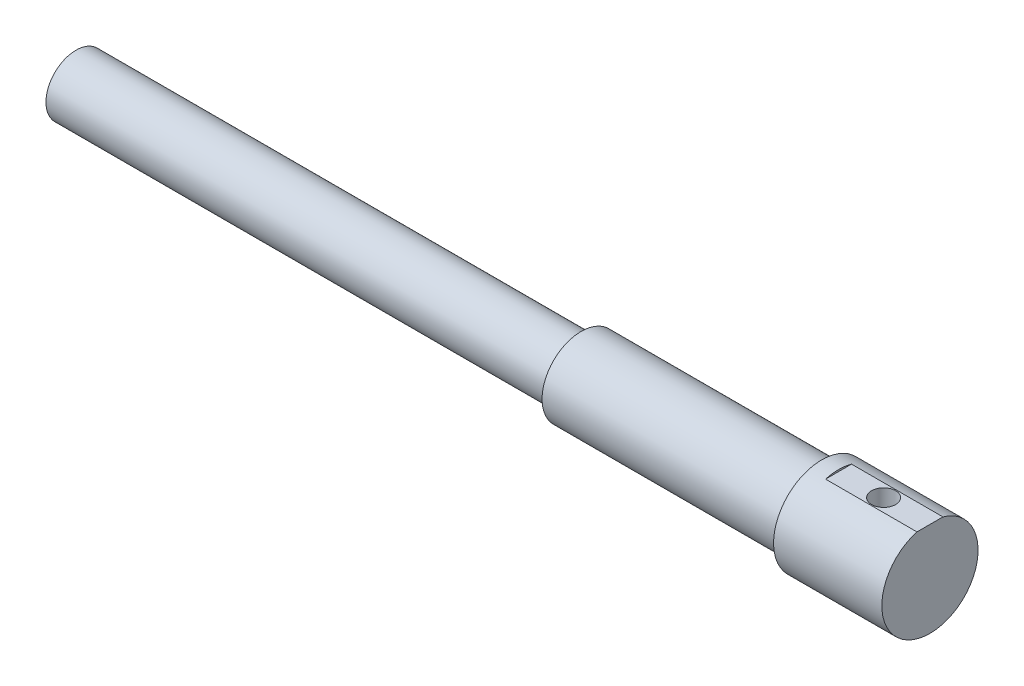
from build123d import *

# Parameters (mm, degrees)
CROQUIS2_R                 = 12.5
SALIENTE_EXTRUIR1_DEPTH    = 210
CROQUIS4_R                 = 16.25
SALIENTE_EXTRUIR2_DEPTH    = 100
CROQUIS5_R                 = 20
SALIENTE_EXTRUIR3_DEPTH    = 45
CROQUIS6_W                 = 10.799694728
CROQUIS6_H                 = 1.485501512
CORTAR_EXTRUIR1_DEPTH      = 38
CORTAR_EXTRUIR2_REACH      = 359.724
CORTAR_EXTRUIR2_END_RADIUS = 20
CROQUIS8_R                 = 5


with BuildPart() as part:
    # Croquis2 → Saliente-Extruir1 (new body)
    with BuildSketch(Plane(origin=(0, 0, 0), x_dir=(0, 0, -1), z_dir=(1, 0, 0))):
        Circle(CROQUIS2_R)
    extrude(amount=SALIENTE_EXTRUIR1_DEPTH)

    # Croquis4 → Saliente-Extruir2 (add)
    with BuildSketch(Plane(origin=(210, 0, 0), x_dir=(0, 0, -1), z_dir=(1, 0, 0))):
        Circle(CROQUIS4_R)
    extrude(amount=SALIENTE_EXTRUIR2_DEPTH)

    # Croquis5 → Saliente-Extruir3 (add)
    with BuildSketch(Plane(origin=(310, 0, 0), x_dir=(0, 0, -1), z_dir=(1, 0, 0))):
        with Locations(Location((0, 0, 0), (0, 0, 180))):
            Circle(CROQUIS5_R)
    extrude(amount=SALIENTE_EXTRUIR3_DEPTH)

    # Croquis6 → Cortar-Extruir1 (cut)
    with BuildSketch(Plane(origin=(355, 0, 0), x_dir=(0, 0, -1), z_dir=(1, 0, 0))):
        with Locations((0, 20)):
            Rectangle(CROQUIS6_W, CROQUIS6_H)
    extrude(amount=-CORTAR_EXTRUIR1_DEPTH, mode=Mode.SUBTRACT)

    # Cortar-Extruir2: up to this cylinder (the profile starts inside it)
    cortar_extruir2_end = Plane(origin=(335.730152, 0, 0), z_dir=(-1, 0, 0)) * Cylinder(CORTAR_EXTRUIR2_END_RADIUS, 760.448, mode=Mode.PRIVATE)
    # Croquis8 → Cortar-Extruir2 (cut, up to the surface)
    with BuildSketch(Plane(origin=(0, 19.257249244, 0), x_dir=(1, 0, 0), z_dir=(0, 1, 0)), mode=Mode.PRIVATE) as cortar_extruir2_sk1:
        with Locations(Location((335.730152453, 0, 0), (0, 0, 270))):
            Circle(CROQUIS8_R)
    cortar_extruir2_tool1 = extrude(cortar_extruir2_sk1.sketch, amount=-CORTAR_EXTRUIR2_REACH, mode=Mode.PRIVATE) & cortar_extruir2_end
    add(cortar_extruir2_tool1.solids().sort_by_distance((335.730152, 19.257249, 0))[0], mode=Mode.SUBTRACT)


solid = part.part
